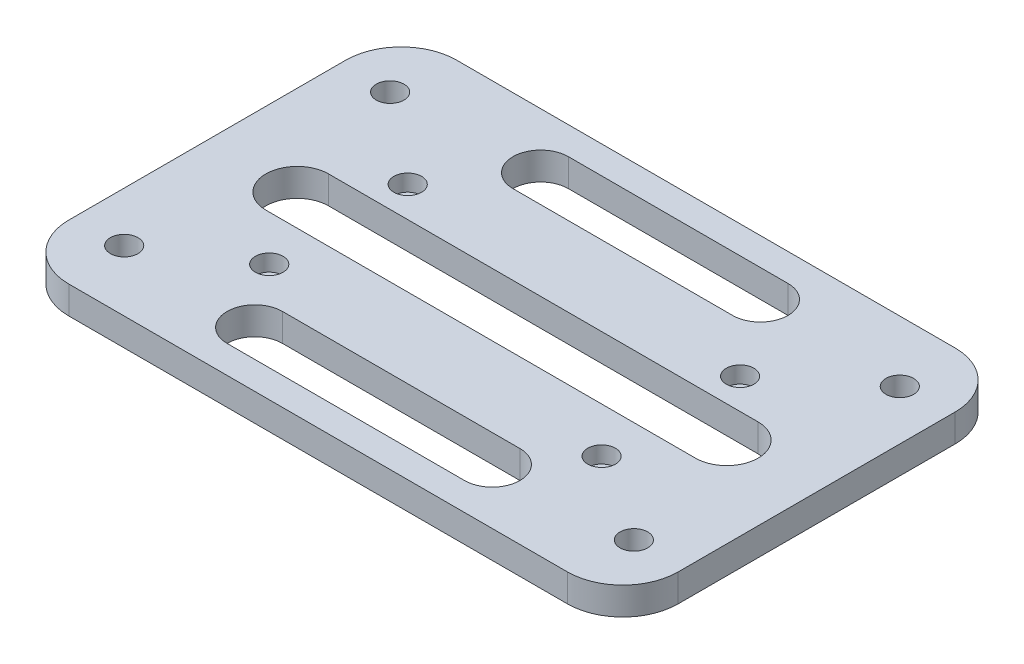
from build123d import *

# Parameters (mm, degrees)
ESQUISSE1_W             = 110
ESQUISSE1_H             = 70
BOSS_EXTRU_1_DEPTH      = 5
ESQUISSE2_R             = 2.5
ESQUISSE2_R_2           = 1.3
ENL_V_MAT_EXTRU_1_DEPTH = 131.479883507
ESQUISSE4_R             = 2.5
ENL_V_MAT_EXTRU_2_DEPTH = 3
ENL_V_MAT_EXTRU_3_DEPTH = 131.479883507
CONG_1_R                = 10


with BuildPart() as part:
    # Esquisse1 → Boss.-Extru.1 (new body)
    with BuildSketch(Plane(origin=(0, 0, 0), x_dir=(1, 0, 0), z_dir=(0, 1, 0))):
        with Locations((55, 35)):
            Rectangle(ESQUISSE1_W, ESQUISSE1_H)
    extrude(amount=BOSS_EXTRU_1_DEPTH)

    # Esquisse2 → Enlèv. mat.-Extru.1 (cut, through all)
    with BuildSketch(Plane(origin=(0, 5, 0), x_dir=(1, 0, 0), z_dir=(0, 1, 0))):
        with Locations(Location((9, 59, 0), (0, 0, 270))):
            Circle(ESQUISSE2_R)
        with Locations(Location((9, 11, 0), (0, 0, 270))):
            Circle(ESQUISSE2_R)
        with Locations(Location((101, 11, 0), (0, 0, 270))):
            Circle(ESQUISSE2_R)
        with Locations(Location((101, 59, 0), (0, 0, 270))):
            Circle(ESQUISSE2_R)
        with Locations(Location((25, 46.176778867, 0), (0, 0, 270))):
            Circle(ESQUISSE2_R_2)
        with Locations(Location((25, 21.176778867, 0), (0, 0, 270))):
            Circle(ESQUISSE2_R_2)
        with Locations(Location((85, 21.176778867, 0), (0, 0, 270))):
            Circle(ESQUISSE2_R_2)
        with Locations(Location((85, 46.176778867, 0), (0, 0, 270))):
            Circle(ESQUISSE2_R_2)
    extrude(amount=-ENL_V_MAT_EXTRU_1_DEPTH, mode=Mode.SUBTRACT)

    # Esquisse4 → Enlèv. mat.-Extru.2 (cut)
    with BuildSketch(Plane(origin=(0, 5, 0), x_dir=(1, 0, 0), z_dir=(0, 1, 0))):
        with Locations(Location((25, 46.176778867, 0), (0, 0, 270))):
            Circle(ESQUISSE4_R)
        with Locations(Location((25, 21.176778867, 0), (0, 0, 270))):
            Circle(ESQUISSE4_R)
        with Locations(Location((85, 21.176778867, 0), (0, 0, 270))):
            Circle(ESQUISSE4_R)
        with Locations(Location((85, 46.176778867, 0), (0, 0, 270))):
            Circle(ESQUISSE4_R)
    extrude(amount=-ENL_V_MAT_EXTRU_2_DEPTH, mode=Mode.SUBTRACT)

    # Esquisse5 → Enlèv. mat.-Extru.3 (cut, through all)
    with BuildSketch(Plane(origin=(0, 5, 0), x_dir=(1, 0, 0), z_dir=(0, 1, 0))):
        with BuildLine():
            Line((35.175146904, 65), (74.824853096, 65))
            ThreePointArc((74.824853096, 65), (79.824853096, 60), (74.824853096, 55))
            Line((74.824853096, 55), (35.175146904, 55))
            ThreePointArc((35.175146904, 55), (30.175146904, 60), (35.175146904, 65))
        make_face()
        with BuildLine():
            Line((16.226090532, 40.659734035), (93.773909468, 40.659734035))
            ThreePointArc((93.773909468, 40.659734035), (99.433643503, 35), (93.773909468, 29.340265965))
            Line((93.773909468, 29.340265965), (16.226090532, 29.340265965))
            ThreePointArc((16.226090532, 29.340265965), (10.566356497, 35), (16.226090532, 40.659734035))
        make_face()
        with BuildLine():
            Line((33.566737233, 15), (76.433262767, 15))
            ThreePointArc((76.433262767, 15), (81.433262767, 10), (76.433262767, 5))
            Line((76.433262767, 5), (33.566737233, 5))
            ThreePointArc((33.566737233, 5), (28.566737233, 10), (33.566737233, 15))
        make_face()
    extrude(amount=-ENL_V_MAT_EXTRU_3_DEPTH, mode=Mode.SUBTRACT)

    # Congé1
    cong_1_edges = [part.edges().sort_by_distance(p)[0] for p in [
        (0, 2.5, -70),
        (110, 2.5, -70),
        (110, 2.5, 0),
        (0, 2.5, 0),
    ]]
    fillet(cong_1_edges, radius=CONG_1_R)


solid = part.part
